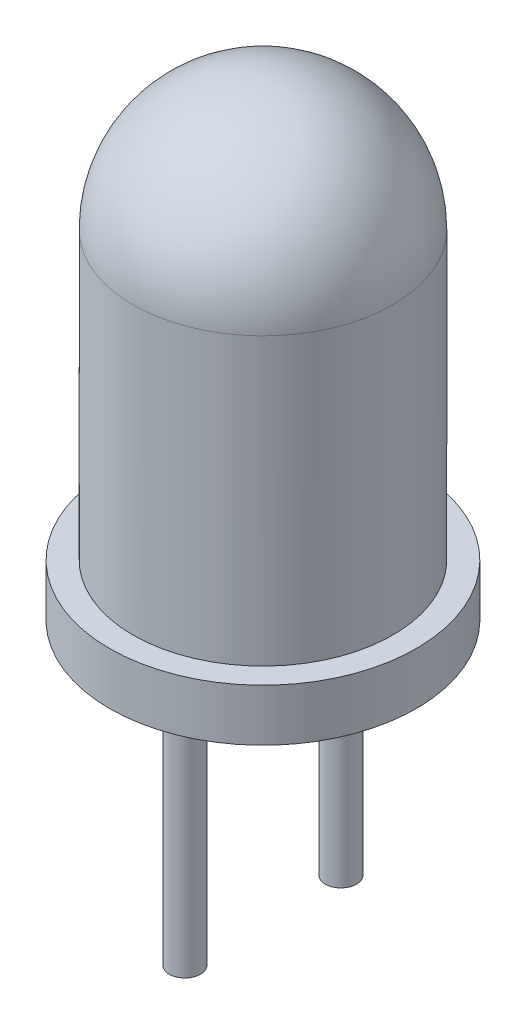
from build123d import *

# Parameters (mm, degrees)
SKETCH1_R           = 2.95
BOSS_EXTRUDE1_DEPTH = 1
SKETCH5_R           = 0.3
BOSS_EXTRUDE2_DEPTH = 5


with BuildPart() as part:
    # Sketch1 → Boss-Extrude1 (new body)
    with BuildSketch(Plane(origin=(0, 0, 0), x_dir=(1, 0, 0), z_dir=(0, 1, 0))):
        with Locations(Location((0, 0, 0), (0, 0, 270))):
            Circle(SKETCH1_R)
    extrude(amount=BOSS_EXTRUDE1_DEPTH)

    # Sketch3 → Revolve1 (revolve)
    with BuildSketch(Plane.XY, mode=Mode.PRIVATE) as revolve1_sk:
        with BuildLine():
            Line((0, 1), (2.5, 1))
            Line((2.5, 1), (2.5, 6.5))
            ThreePointArc((2.5, 6.5), (1.767766953, 8.267766953), (0, 9))
            Line((0, 9), (0, 6.5))
            Line((0, 6.5), (0, 1))
        make_face()
    revolve(revolve1_sk.sketch.rotate(Axis((0, 1, 0), (0, 1, 0)), 90), axis=Axis((0, 1, 0), (0, 1, 0)))

    # Sketch5 → Boss-Extrude2 (add)
    with BuildSketch(Plane.XZ):
        with Locations(Location((0, 1.5, 0), (0, 0, 90))):
            Circle(SKETCH5_R)
    boss_extrude2 = extrude(amount=BOSS_EXTRUDE2_DEPTH)

    # Mirror1: Boss-Extrude2 across plane
    add(boss_extrude2.mirror(Plane.XY))


solid = part.part
